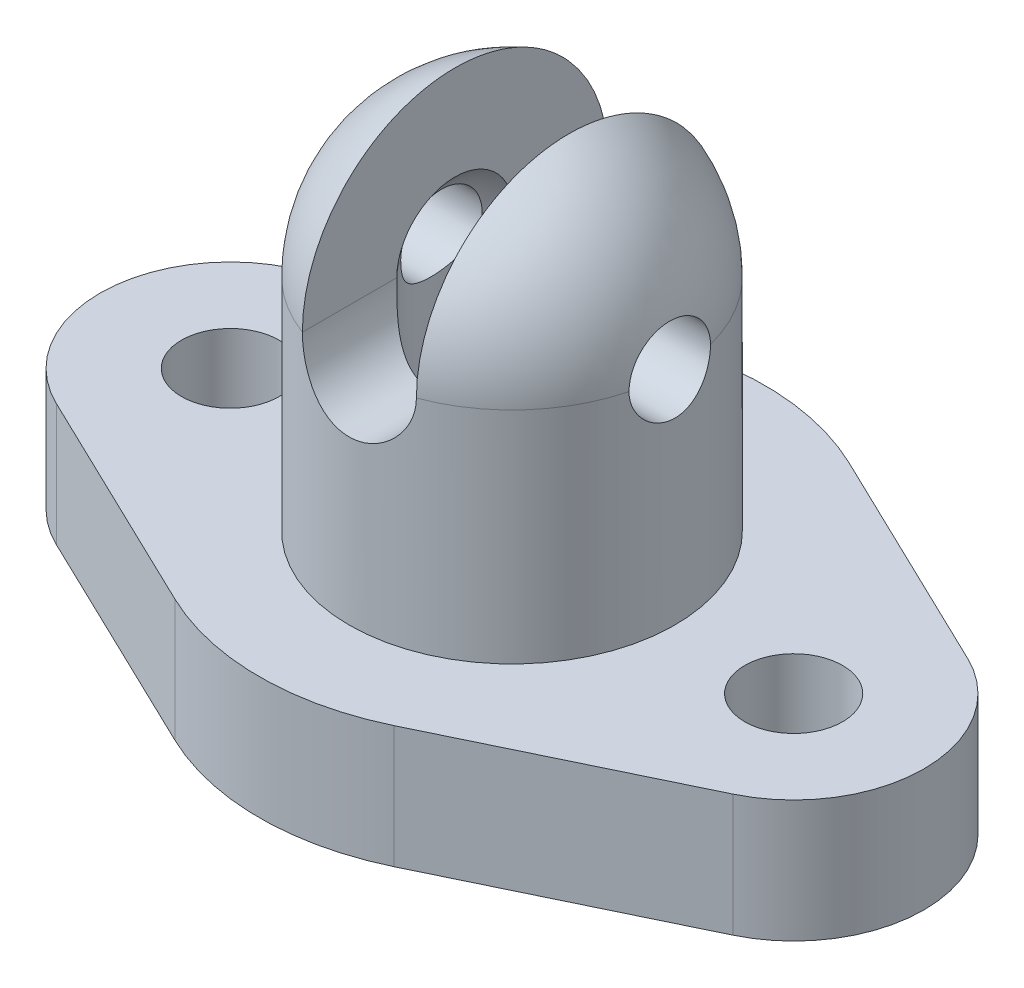
from build123d import *

# Parameters (mm, degrees)
SKETCH1_R               = 6.000000000045659
SKETCH1_R_2             = 6.000000000000002
BOSS_EXTRUDE3_DEPTH     = 15
CUT_EXTRUDE1_DEPTH      = 86.80768734285536
CUT_EXTRUDE1_DEPTH_BACK = 86.80768734285536
CUT_EXTRUDE2_DEPTH      = 85.89816666292398
CUT_EXTRUDE2_DEPTH_BACK = 85.89816666292398
SKETCH8_R               = 4.999999999999999


with BuildPart() as part:
    # Sketch1 → Boss-Extrude3 (new body)
    with BuildSketch(Plane(origin=(0, 0, 0), x_dir=(1, 0, 0), z_dir=(0, 1, 0))):
        with BuildLine():
            Line((13.448529411746133, -27.930933687605208), (41.51744765706708, -14.415965774247848))
            ThreePointArc((41.51744765706708, -14.415965774247848), (50.57627118648844, 3.55e-15), (41.51744765706708, 14.415965774247855))
            Line((41.51744765706708, 14.415965774247855), (13.448529411746131, 27.930933687605208))
            ThreePointArc((13.448529411746131, 27.930933687605208), (1.9e-15, 31.000000000000004), (-13.448529411746135, 27.930933687605208))
            Line((-13.448529411746135, 27.930933687605208), (-41.51744765706708, 14.415965774247852))
            ThreePointArc((-41.51744765706708, 14.415965774247852), (-50.576271186488434, 1.96e-15), (-41.51744765706708, -14.415965774247852))
            Line((-41.51744765706708, -14.415965774247852), (-13.448529411746136, -27.93093368760521))
            ThreePointArc((-13.448529411746136, -27.93093368760521), (1.9e-15, -31.000000000000007), (13.448529411746133, -27.930933687605208))
        make_face()
        with Locations(Location((-34.57627118648843, 0, 0), (0, 0, 270))):
            Circle(SKETCH1_R, mode=Mode.SUBTRACT)
        with Locations(Location((34.57627118648844, 0, 0), (0, 0, 270))):
            Circle(SKETCH1_R_2, mode=Mode.SUBTRACT)
    extrude(amount=BOSS_EXTRUDE3_DEPTH)

    # Sketch5 → Revolve1 (revolve)
    with BuildSketch(Plane.XY):
        with BuildLine():
            Line((0, 0), (0, 42))
            Line((0, 42), (-6.983e-14, 62.00000000000001))
            ThreePointArc((-6.983e-14, 62.00000000000001), (-14.14213562373098, 56.14213562373093), (-20, 42))
            Line((-20, 42), (-19.999999999999996, 0))
            Line((-19.999999999999996, 0), (0, 0))
        make_face()
    revolve(axis=Axis((0, 0, 0), (0, 1, 0)))

    # Sketch6 → Cut-Revolve1 (revolve, cut)
    with BuildSketch(Plane.XY):
        with BuildLine():
            Line((-1.73e-15, 0), (0, 42))
            Line((0, 42), (0, 52.00000000000001))
            ThreePointArc((0, 52.00000000000001), (-7.07106781186548, 49.07106781186548), (-9.999999999999998, 42))
            Line((-9.999999999999998, 42), (-9.999999999999995, 2.1e-16))
            Line((-9.999999999999995, 2.1e-16), (-1.73e-15, 0))
        make_face()
    revolve(axis=Axis((-1.73e-15, 0, 0), (4e-17, 1, 0)), mode=Mode.SUBTRACT)

    # Sketch7 → Cut-Extrude1 (cut, two sides: drawn at the far end of the back side and taken through both)
    with BuildSketch(Plane.XY.offset(-CUT_EXTRUDE1_DEPTH_BACK)):
        with BuildLine():
            Line((-6.999999999999999, 42), (-6.999999999999999, 60.734993995195204))
            ThreePointArc((-6.999999999999999, 60.734993995195204), (1.22e-15, 62.00000000000001), (6.999999999999999, 60.734993995195204))
            Line((6.999999999999999, 60.734993995195204), (6.999999999999999, 42))
            ThreePointArc((6.999999999999999, 42), (-1.29e-15, 35), (-6.999999999999999, 42))
        make_face()
    extrude(amount=CUT_EXTRUDE1_DEPTH + CUT_EXTRUDE1_DEPTH_BACK, mode=Mode.SUBTRACT)

    # Sketch8 → Cut-Extrude2 (cut, two sides: drawn at the far end of the back side and taken through both)
    with BuildSketch(Plane(origin=(0, 0, 0), x_dir=(0, 0, -1), z_dir=(1, 0, 0)).offset(-CUT_EXTRUDE2_DEPTH_BACK)):
        with Locations((3.47e-15, 42)):
            Circle(SKETCH8_R)
    extrude(amount=CUT_EXTRUDE2_DEPTH + CUT_EXTRUDE2_DEPTH_BACK, mode=Mode.SUBTRACT)


solid = part.part
